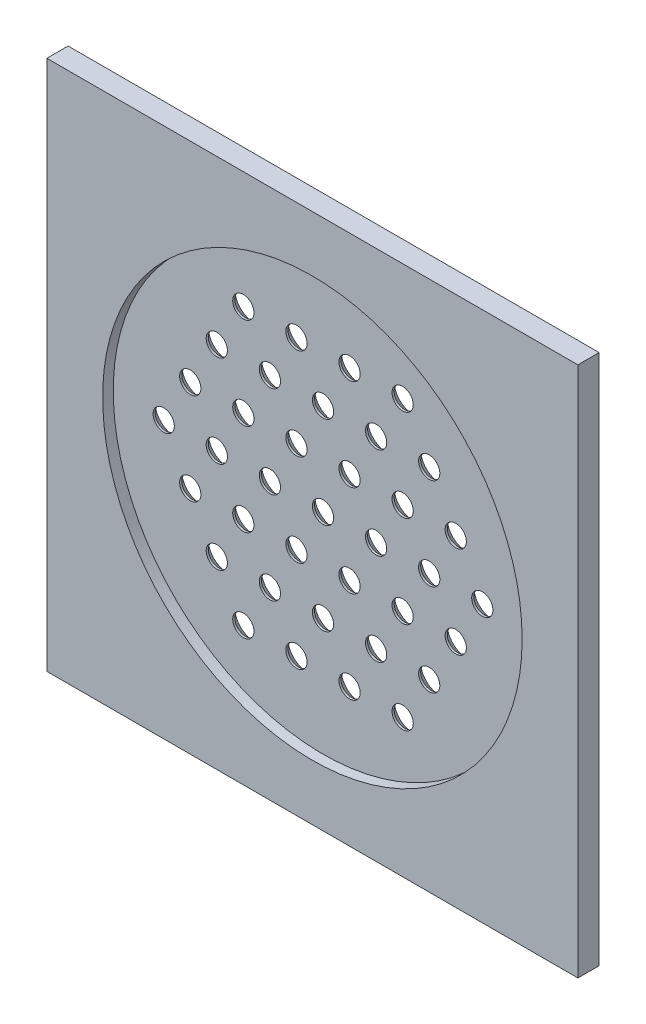
from build123d import *

# Parameters (mm, degrees)
SKETCH_1_W             = 50
SKETCH_1_H             = 50
EXTRUDE_1_DEPTH        = 2
SKETCH_2_R             = 1
CUT_EXTRUDE_1849_DEPTH = 71.738956735
SKETCH_3_R             = 19.75
CUT_EXTRUDE_2321_DEPTH = 1
CHAMFER_1_SIZE         = 0.8


with BuildPart() as part:
    # Эскиз1 → Бобышка-Вытянуть1 (new body)
    with BuildSketch(Plane(origin=(0, 66.754264805, 0), x_dir=(-1, 0, 0), z_dir=(0, 0, 1))):
        with Locations((25, 41.754264805)):
            Rectangle(SKETCH_1_W, SKETCH_1_H)
    extrude(amount=EXTRUDE_1_DEPTH)

    # Эскиз2 → Cut-Extrude 1849 (cut, through all)
    with BuildSketch(Plane.XY.offset(2)):
        with Locations((-25, 25)):
            Circle(SKETCH_2_R)
        with Locations((-20, 25)):
            Circle(SKETCH_2_R)
        with Locations((-15, 25)):
            Circle(SKETCH_2_R)
        with Locations((-10, 25)):
            Circle(SKETCH_2_R)
        with Locations((-22.5, 20.669872981)):
            Circle(SKETCH_2_R)
        with Locations((-20, 16.339745962)):
            Circle(SKETCH_2_R)
        with Locations((-17.5, 12.009618943)):
            Circle(SKETCH_2_R)
        with Locations((-27.5, 20.669872981)):
            Circle(SKETCH_2_R)
        with Locations((-30, 16.339745962)):
            Circle(SKETCH_2_R)
        with Locations((-32.5, 12.009618943)):
            Circle(SKETCH_2_R)
        with Locations((-30, 25)):
            Circle(SKETCH_2_R)
        with Locations((-35, 25)):
            Circle(SKETCH_2_R)
        with Locations((-40, 25)):
            Circle(SKETCH_2_R)
        with Locations((-27.5, 29.330127019)):
            Circle(SKETCH_2_R)
        with Locations((-30, 33.660254038)):
            Circle(SKETCH_2_R)
        with Locations((-32.5, 37.990381057)):
            Circle(SKETCH_2_R)
        with Locations((-22.5, 29.330127019)):
            Circle(SKETCH_2_R)
        with Locations((-20, 33.660254038)):
            Circle(SKETCH_2_R)
        with Locations((-17.5, 37.990381057)):
            Circle(SKETCH_2_R)
        with Locations((-25, 16.339745962)):
            Circle(SKETCH_2_R)
        with Locations((-27.5, 12.009618943)):
            Circle(SKETCH_2_R)
        with Locations((-22.5, 12.009618943)):
            Circle(SKETCH_2_R)
        with Locations((-32.5, 20.669872981)):
            Circle(SKETCH_2_R)
        with Locations((-37.5, 20.669872981)):
            Circle(SKETCH_2_R)
        with Locations((-35, 16.339745962)):
            Circle(SKETCH_2_R)
        with Locations((-32.5, 29.330127019)):
            Circle(SKETCH_2_R)
        with Locations((-35, 33.660254038)):
            Circle(SKETCH_2_R)
        with Locations((-37.5, 29.330127019)):
            Circle(SKETCH_2_R)
        with Locations((-25, 33.660254038)):
            Circle(SKETCH_2_R)
        with Locations((-22.5, 37.990381057)):
            Circle(SKETCH_2_R)
        with Locations((-27.5, 37.990381057)):
            Circle(SKETCH_2_R)
        with Locations((-17.5, 29.330127019)):
            Circle(SKETCH_2_R)
        with Locations((-12.5, 29.330127019)):
            Circle(SKETCH_2_R)
        with Locations((-15, 33.660254038)):
            Circle(SKETCH_2_R)
        with Locations((-17.5, 20.669872981)):
            Circle(SKETCH_2_R)
        with Locations((-15, 16.339745962)):
            Circle(SKETCH_2_R)
        with Locations((-12.5, 20.669872981)):
            Circle(SKETCH_2_R)
    extrude(amount=-CUT_EXTRUDE_1849_DEPTH, mode=Mode.SUBTRACT)

    # Эскиз3 → Cut-Extrude 2321 (cut)
    with BuildSketch(Plane.XY.offset(2)):
        with Locations((-25, 25)):
            Circle(SKETCH_3_R)
    extrude(amount=-CUT_EXTRUDE_2321_DEPTH, mode=Mode.SUBTRACT)

    # Фаска1
    chamfer_1_edges = [part.edges().sort_by_distance(p)[0] for p in [
        (-33.5, 12.009618943, 0),
        (-31, 25, 0),
        (-36, 25, 0),
        (-41, 25, 0),
        (-23.5, 29.330127019, 0),
        (-33.5, 37.990381057, 0),
        (-31, 33.660254038, 0),
        (-28.5, 29.330127019, 0),
        (-13.5, 20.669872981, 0),
        (-16, 16.339745962, 0),
        (-18.5, 20.669872981, 0),
        (-16, 33.660254038, 0),
        (-26, 25, 0),
        (-36, 16.339745962, 0),
        (-38.5, 20.669872981, 0),
        (-33.5, 20.669872981, 0),
        (-23.5, 12.009618943, 0),
        (-28.5, 12.009618943, 0),
        (-26, 16.339745962, 0),
        (-18.5, 37.990381057, 0),
        (-21, 33.660254038, 0),
        (-13.5, 29.330127019, 0),
        (-18.5, 29.330127019, 0),
        (-28.5, 37.990381057, 0),
        (-23.5, 37.990381057, 0),
        (-33.5, 29.330127019, 0),
        (-36, 33.660254038, 0),
        (-38.5, 29.330127019, 0),
        (-26, 33.660254038, 0),
        (-31, 16.339745962, 0),
        (-28.5, 20.669872981, 0),
        (-18.5, 12.009618943, 0),
        (-21, 16.339745962, 0),
        (-21, 25, 0),
        (-16, 25, 0),
        (-11, 25, 0),
        (-23.5, 20.669872981, 0),
    ]]
    chamfer(chamfer_1_edges, length=CHAMFER_1_SIZE)


solid = part.part
